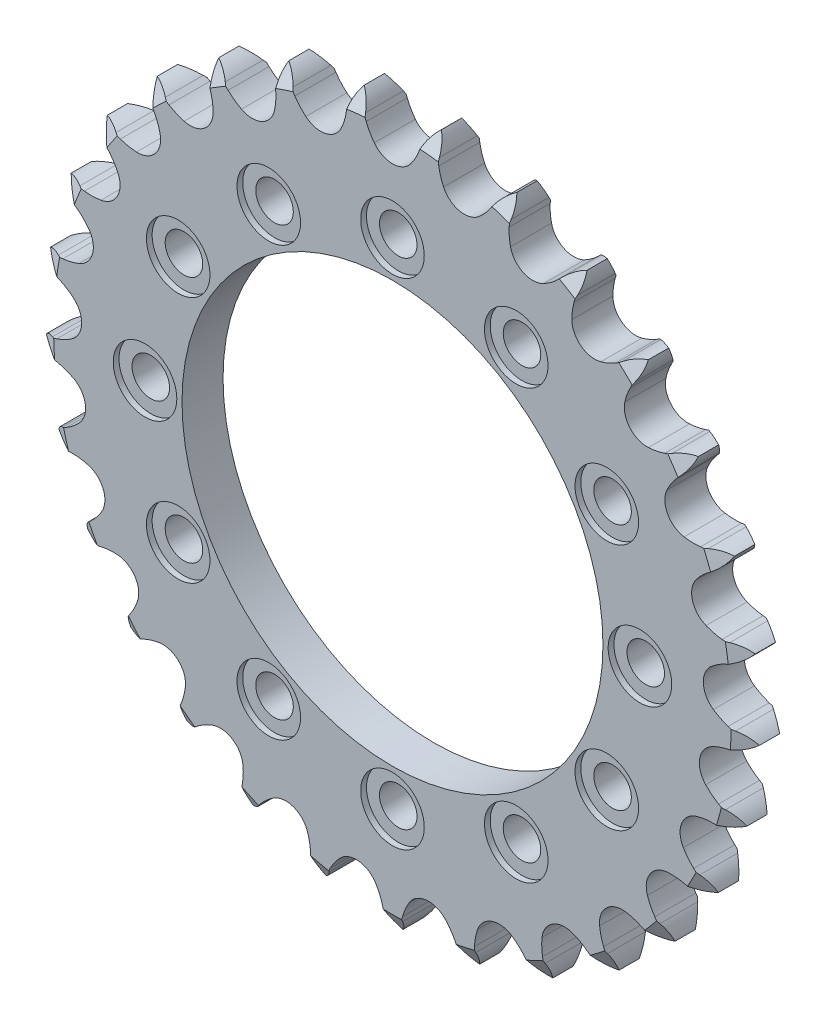
from build123d import *

# Parameters (mm, degrees)
EXTRUSION_DEPTH         = 7.2136
CIRPATTERN1_COUNT       = 12
CUT_EXTRUDE1_DEPTH      = 89.992024243
CUT_EXTRUDE1_DEPTH_BACK = 89.992024243
SKETCH8_R               = 37
CUT_EXTRUDE2_START      = 7.2136
SKETCH10_R              = 5.588
CUT_EXTRUDE2_DEPTH      = 1.016
CIRPATTERN2_COUNT       = 12


with BuildPart() as part:
    # Teeth Sketch → Extrusion (new body)
    with BuildSketch(Plane.XY):
        with BuildLine():
            ThreePointArc((6.786176664, 62.397863982), (5.741537534, 61.231594455), (5.007677749, 59.848516243))
            Line((5.007677749, 59.848516243), (4.620746237, 58.840525191))
            ThreePointArc((4.620746237, 58.840525191), (3.998321078, 57.527942204), (3.198691208, 56.315144097))
            ThreePointArc((3.198691208, 56.315144097), (0, 54.72273841), (-3.198691208, 56.315144097))
            ThreePointArc((-3.198691208, 56.315144097), (-3.998321078, 57.527942204), (-4.620746237, 58.840525191))
            Line((-4.620746237, 58.840525191), (-5.007677749, 59.848516243))
            ThreePointArc((-5.007677749, 59.848516243), (-5.741537534, 61.231594455), (-6.786176664, 62.397863982))
            ThreePointArc((-6.786176664, 62.397863982), (-7.555679238, 61.034294654), (-7.975060857, 59.525793882))
            Line((-7.975060857, 59.525793882), (-8.136257845, 58.458190263))
            ThreePointArc((-8.136257845, 58.458190263), (-8.461964507, 57.042491726), (-8.982183732, 55.68615138))
            ThreePointArc((-8.982183732, 55.68615138), (-11.763771166, 53.443351196), (-15.229998902, 54.310903266))
            ThreePointArc((-15.229998902, 54.310903266), (-16.271649613, 55.323450042), (-17.16168936, 56.471542558))
            Line((-17.16168936, 56.471542558), (-17.756262909, 57.372788502))
            ThreePointArc((-17.756262909, 57.372788502), (-18.770286392, 58.565772952), (-20.041215913, 59.480209213))
            ThreePointArc((-20.041215913, 59.480209213), (-20.499600846, 57.983099071), (-20.58489448, 56.419711557))
            Line((-20.58489448, 56.419711557), (-20.512819553, 55.34241533))
            ThreePointArc((-20.512819553, 55.34241533), (-20.526578036, 53.889797734), (-20.743061744, 52.453336116))
            ThreePointArc((-20.743061744, 52.453336116), (-22.977481466, 49.665012278), (-26.549168775, 49.767144961))
            ThreePointArc((-26.549168775, 49.767144961), (-27.784133897, 50.532094843), (-28.900170963, 51.462013358))
            Line((-28.900170963, 51.462013358), (-29.674584949, 52.214372935))
            ThreePointArc((-29.674584949, 52.214372935), (-30.92135752, 53.161480998), (-32.359150181, 53.781325968))
            ThreePointArc((-32.359150181, 53.781325968), (-32.484983902, 52.220678218), (-32.232201317, 50.675506225))
            Line((-32.232201317, 50.675506225), (-31.930224617, 49.638890565))
            ThreePointArc((-31.930224617, 49.638890565), (-31.63139159, 48.217276693), (-31.534017243, 46.767861152))
            ThreePointArc((-31.534017243, 46.767861152), (-33.11679027, 43.564392585), (-36.626929023, 42.896330269))
            ThreePointArc((-36.626929023, 42.896330269), (-37.99746296, 43.377915052), (-39.287312692, 44.04617761))
            Line((-39.287312692, 44.04617761), (-40.205356379, 44.614471322))
            ThreePointArc((-40.205356379, 44.614471322), (-41.626580336, 45.271417276), (-43.16400655, 45.567687695))
            ThreePointArc((-43.16400655, 45.567687695), (-42.951405215, 44.016476492), (-42.372366243, 42.561770545))
            Line((-42.372366243, 42.561770545), (-41.854607866, 41.614306446))
            ThreePointArc((-41.854607866, 41.614306446), (-41.257156429, 40.290169385), (-40.850477143, 38.895572979))
            ThreePointArc((-40.850477143, 38.895572979), (-41.707594769, 35.426750312), (-44.992054777, 34.019730849))
            ThreePointArc((-44.992054777, 34.019730849), (-46.434072886, 34.195432164), (-47.837423344, 34.57079155))
            Line((-47.837423344, 34.57079155), (-48.856170029, 34.928446616))
            ThreePointArc((-48.856170029, 34.928446616), (-50.385390521, 35.264512399), (-51.950561947, 35.223354989))
            ThreePointArc((-51.950561947, 35.223354989), (-51.409466558, 33.754113245), (-50.531246417, 32.457893777))
            Line((-50.531246417, 32.457893777), (-49.821916169, 31.643883609))
            ThreePointArc((-49.821916169, 31.643883609), (-48.953782488, 30.479138535), (-48.256814134, 29.204571043))
            ThreePointArc((-48.256814134, 29.204571043), (-48.34819849, 25.632592569), (-51.253402056, 23.552406626))
            ThreePointArc((-51.253402056, 23.552406626), (-52.699477171, 23.414008874), (-54.150709248, 23.478913701))
            Line((-54.150709248, 23.478913701), (-55.222523469, 23.609206566))
            ThreePointArc((-55.222523469, 23.609206566), (-56.788235845, 23.608678115), (-58.307966806, 23.232017353))
            ThreePointArc((-58.307966806, 23.232017353), (-57.463678382, 21.913445178), (-56.32734167, 20.836321971))
            Line((-56.32734167, 20.836321971), (-55.459607045, 20.193827944))
            ThreePointArc((-55.459607045, 20.193827944), (-54.361384085, 19.242937042), (-53.406716129, 18.147995824))
            ThreePointArc((-53.406716129, 18.147995824), (-52.728094186, 14.639883287), (-55.118197218, 11.983798045))
            ThreePointArc((-55.118197218, 11.983798045), (-56.500712475, 11.537772552), (-57.931968171, 11.289187941))
            Line((-57.931968171, 11.289187941), (-59.006733086, 11.186026256))
            ThreePointArc((-59.006733086, 11.186026256), (-60.535726376, 10.848928282), (-61.938955941, 10.154376405))
            ThreePointArc((-61.938955941, 10.154376405), (-60.830952471, 9.048128769), (-59.48963303, 8.240466908))
            Line((-59.48963303, 8.240466908), (-58.504068334, 7.799531329))
            ThreePointArc((-58.504068334, 7.799531329), (-57.227107781, 7.1069572), (-56.059379436, 6.24284049))
            ThreePointArc((-56.059379436, 6.24284049), (-54.6424828, 2.962629332), (-56.405726738, -0.145159614))
            ThreePointArc((-56.405726738, -0.145159614), (-57.66003726, -0.877957192), (-59.00439265, -1.4284077))
            Line((-59.00439265, -1.4284077), (-60.031853446, -1.760200208))
            ThreePointArc((-60.031853446, -1.760200208), (-61.452633622, -2.41810538), (-62.673748337, -3.398071897))
            ThreePointArc((-62.673748337, -3.398071897), (-61.353838831, -4.240268084), (-59.870255268, -4.74070323))
            Line((-59.870255268, -4.74070323), (-58.812944411, -4.959462704))
            ThreePointArc((-58.812944411, -4.959462704), (-57.416955521, -5.361336062), (-56.090768466, -5.954223127))
            ThreePointArc((-56.090768466, -5.954223127), (-54.001849649, -8.853153877), (-55.055787166, -12.26732977))
            ThreePointArc((-55.055787166, -12.26732977), (-56.123242787, -13.252634633), (-57.317837307, -14.079212584))
            Line((-57.317837307, -14.079212584), (-58.249951059, -14.624121667))
            ThreePointArc((-58.249951059, -14.624121667), (-59.49608402, -15.572071122), (-60.477985918, -16.791630134))
            ThreePointArc((-60.477985918, -16.791630134), (-59.007887877, -17.330394715), (-57.45141091, -17.500203353))
            Line((-57.45141091, -17.500203353), (-56.371792573, -17.486557772))
            ThreePointArc((-56.371792573, -17.486557772), (-54.922050235, -17.578939208), (-53.499415503, -17.872873888))
            ThreePointArc((-53.499415503, -17.872873888), (-50.836150027, -20.25497345), (-51.131500176, -23.81589322))
            ThreePointArc((-51.131500176, -23.81589322), (-51.962187858, -25.007633608), (-52.951163596, -26.071689135))
            Line((-52.951163596, -26.071689135), (-53.744345701, -26.804235451))
            ThreePointArc((-53.744345701, -26.804235451), (-54.757563654, -27.997904125), (-55.454340094, -29.400030409))
            ThreePointArc((-55.454340094, -29.400030409), (-53.902793669, -29.61017135), (-52.34620243, -29.441413418))
            Line((-52.34620243, -29.441413418), (-51.294758367, -29.196000833))
            ThreePointArc((-51.294758367, -29.196000833), (-49.859050921, -28.974570694), (-48.406489331, -28.95580893))
            ThreePointArc((-48.406489331, -28.95580893), (-45.293408531, -30.709692977), (-44.816361067, -34.250851973))
            ThreePointArc((-44.816361067, -34.250851973), (-45.371438776, -35.593303429), (-46.108552326, -36.84508248))
            Line((-46.108552326, -36.84508248), (-46.72571447, -37.731012976))
            ThreePointArc((-46.72571447, -37.731012976), (-47.45864047, -39.114586249), (-47.83771096, -40.633717937))
            ThreePointArc((-47.83771096, -40.633717937), (-46.277264737, -40.505409282), (-44.793343704, -40.005975713))
            Line((-44.793343704, -40.005975713), (-43.81923827, -39.540271345))
            ThreePointArc((-43.81923827, -39.540271345), (-42.464697801, -39.015383458), (-41.050129518, -38.684802529))
            ThreePointArc((-41.050129518, -38.684802529), (-37.632797591, -39.728461391), (-36.405658724, -43.084278955))
            ThreePointArc((-36.405658724, -43.084278955), (-36.659171644, -44.514669942), (-37.109956396, -45.895640718))
            Line((-37.109956396, -45.895640718), (-37.522240763, -46.893530269))
            ThreePointArc((-37.522240763, -46.893530269), (-37.940604005, -48.402313792), (-37.984243629, -49.967417976))
            ThreePointArc((-37.984243629, -49.967417976), (-36.48786234, -49.506659295), (-35.14599801, -48.699903047))
            Line((-35.14599801, -48.699903047), (-34.294779293, -48.035682714))
            ThreePointArc((-34.294779293, -48.035682714), (-33.084742607, -47.231880253), (-31.774311273, -46.604937757))
            ThreePointArc((-31.774311273, -46.604937757), (-28.212518863, -46.889571106), (-26.292668241, -49.903132937))
            ThreePointArc((-26.292668241, -49.903132937), (-26.23276239, -51.354579962), (-26.376140149, -52.800169805))
            Line((-26.376140149, -52.800169805), (-26.56426878, -53.863358205))
            ThreePointArc((-26.56426878, -53.863358205), (-26.648507064, -55.426802938), (-26.354675283, -56.964697085))
            ThreePointArc((-26.354675283, -56.964697085), (-24.992328053, -56.193032942), (-23.855264512, -55.116677041))
            Line((-23.855264512, -55.116677041), (-23.166734552, -54.284998948))
            ThreePointArc((-23.166734552, -54.284998948), (-22.157781621, -53.239866823), (-21.012761547, -52.345877892))
            ThreePointArc((-21.012761547, -52.345877892), (-17.473054108, -51.85817659), (-14.950261813, -54.388571887))
            ThreePointArc((-14.950261813, -54.388571887), (-14.579738322, -55.793206899), (-14.409004903, -57.235821635))
            Line((-14.409004903, -57.235821635), (-14.364181114, -58.314595376))
            ThreePointArc((-14.364181114, -58.314595376), (-14.110355551, -59.859596381), (-13.492791611, -61.298370271))
            ThreePointArc((-13.492791611, -61.298370271), (-12.328180284, -60.251882822), (-11.449085358, -58.956256474))
            Line((-11.449085358, -58.956256474), (-10.955439051, -57.996008964))
            ThreePointArc((-10.955439051, -57.996008964), (-10.194747392, -56.758416391), (-9.268678445, -55.639182956))
            ThreePointArc((-9.268678445, -55.639182956), (-5.916568762, -54.401951373), (-2.908797759, -56.330861663))
            ThreePointArc((-2.908797759, -56.330861663), (-2.244981894, -57.623005492), (-1.768120603, -58.995190059))
            Line((-1.768120603, -58.995190059), (-1.492440303, -60.039106879))
            ThreePointArc((-1.492440303, -60.039106879), (-0.912419494, -61.493421627), (0, -62.76579979))
            ThreePointArc((0, -62.76579979), (0.912419494, -61.493421627), (1.492440303, -60.039106879))
            Line((1.492440303, -60.039106879), (1.768120603, -58.995190059))
            ThreePointArc((1.768120603, -58.995190059), (2.244981894, -57.623005492), (2.908797759, -56.330861663))
            ThreePointArc((2.908797759, -56.330861663), (5.916568762, -54.401951373), (9.268678445, -55.639182956))
            ThreePointArc((9.268678445, -55.639182956), (10.194747392, -56.758416391), (10.955439051, -57.996008964))
            Line((10.955439051, -57.996008964), (11.449085358, -58.956256474))
            ThreePointArc((11.449085358, -58.956256474), (12.328180284, -60.251882822), (13.492791611, -61.298370271))
            ThreePointArc((13.492791611, -61.298370271), (14.110355551, -59.859596381), (14.364181114, -58.314595376))
            Line((14.364181114, -58.314595376), (14.409004903, -57.235821635))
            ThreePointArc((14.409004903, -57.235821635), (14.579738322, -55.793206899), (14.950261813, -54.388571887))
            ThreePointArc((14.950261813, -54.388571887), (17.473054108, -51.85817659), (21.012761547, -52.345877892))
            ThreePointArc((21.012761547, -52.345877892), (22.157781621, -53.239866823), (23.166734552, -54.284998948))
            Line((23.166734552, -54.284998948), (23.855264512, -55.116677041))
            ThreePointArc((23.855264512, -55.116677041), (24.992328053, -56.193032942), (26.354675283, -56.964697085))
            ThreePointArc((26.354675283, -56.964697085), (26.648507064, -55.426802938), (26.56426878, -53.863358205))
            Line((26.56426878, -53.863358205), (26.376140149, -52.800169805))
            ThreePointArc((26.376140149, -52.800169805), (26.23276239, -51.354579962), (26.292668241, -49.903132937))
            ThreePointArc((26.292668241, -49.903132937), (28.212518863, -46.889571106), (31.774311273, -46.604937757))
            ThreePointArc((31.774311273, -46.604937757), (33.084742607, -47.231880253), (34.294779293, -48.035682714))
            Line((34.294779293, -48.035682714), (35.14599801, -48.699903047))
            ThreePointArc((35.14599801, -48.699903047), (36.48786234, -49.506659295), (37.984243629, -49.967417976))
            ThreePointArc((37.984243629, -49.967417976), (37.940604005, -48.402313792), (37.522240763, -46.893530269))
            Line((37.522240763, -46.893530269), (37.109956396, -45.895640718))
            ThreePointArc((37.109956396, -45.895640718), (36.659171644, -44.514669942), (36.405658724, -43.084278955))
            ThreePointArc((36.405658724, -43.084278955), (37.632797591, -39.728461391), (41.050129518, -38.684802529))
            ThreePointArc((41.050129518, -38.684802529), (42.464697801, -39.015383458), (43.81923827, -39.540271345))
            Line((43.81923827, -39.540271345), (44.793343704, -40.005975713))
            ThreePointArc((44.793343704, -40.005975713), (46.277264737, -40.505409282), (47.83771096, -40.633717937))
            ThreePointArc((47.83771096, -40.633717937), (47.45864047, -39.114586249), (46.72571447, -37.731012976))
            Line((46.72571447, -37.731012976), (46.108552326, -36.84508248))
            ThreePointArc((46.108552326, -36.84508248), (45.371438776, -35.593303429), (44.816361067, -34.250851973))
            ThreePointArc((44.816361067, -34.250851973), (45.293408531, -30.709692977), (48.406489331, -28.95580893))
            ThreePointArc((48.406489331, -28.95580893), (49.859050921, -28.974570694), (51.294758367, -29.196000833))
            Line((51.294758367, -29.196000833), (52.34620243, -29.441413418))
            ThreePointArc((52.34620243, -29.441413418), (53.902793669, -29.61017135), (55.454340094, -29.400030409))
            ThreePointArc((55.454340094, -29.400030409), (54.757563654, -27.997904125), (53.744345701, -26.804235451))
            Line((53.744345701, -26.804235451), (52.951163596, -26.071689135))
            ThreePointArc((52.951163596, -26.071689135), (51.962187858, -25.007633608), (51.131500176, -23.81589322))
            ThreePointArc((51.131500176, -23.81589322), (50.836150027, -20.25497345), (53.499415503, -17.872873888))
            ThreePointArc((53.499415503, -17.872873888), (54.922050235, -17.578939208), (56.371792573, -17.486557772))
            Line((56.371792573, -17.486557772), (57.45141091, -17.500203353))
            ThreePointArc((57.45141091, -17.500203353), (59.007887877, -17.330394715), (60.477985918, -16.791630134))
            ThreePointArc((60.477985918, -16.791630134), (59.49608402, -15.572071122), (58.249951059, -14.624121667))
            Line((58.249951059, -14.624121667), (57.317837307, -14.079212584))
            ThreePointArc((57.317837307, -14.079212584), (56.123242787, -13.252634633), (55.055787166, -12.26732977))
            ThreePointArc((55.055787166, -12.26732977), (54.001849649, -8.853153877), (56.090768466, -5.954223127))
            ThreePointArc((56.090768466, -5.954223127), (57.416955521, -5.361336062), (58.812944411, -4.959462704))
            Line((58.812944411, -4.959462704), (59.870255268, -4.74070323))
            ThreePointArc((59.870255268, -4.74070323), (61.353838831, -4.240268084), (62.673748337, -3.398071897))
            ThreePointArc((62.673748337, -3.398071897), (61.452633622, -2.41810538), (60.031853446, -1.760200208))
            Line((60.031853446, -1.760200208), (59.00439265, -1.4284077))
            ThreePointArc((59.00439265, -1.4284077), (57.66003726, -0.877957192), (56.405726738, -0.145159614))
            ThreePointArc((56.405726738, -0.145159614), (54.6424828, 2.962629332), (56.059379436, 6.24284049))
            ThreePointArc((56.059379436, 6.24284049), (57.227107781, 7.1069572), (58.504068334, 7.799531329))
            Line((58.504068334, 7.799531329), (59.48963303, 8.240466908))
            ThreePointArc((59.48963303, 8.240466908), (60.830952471, 9.048128769), (61.938955941, 10.154376405))
            ThreePointArc((61.938955941, 10.154376405), (60.535726376, 10.848928282), (59.006733086, 11.186026256))
            Line((59.006733086, 11.186026256), (57.931968171, 11.289187941))
            ThreePointArc((57.931968171, 11.289187941), (56.500712475, 11.537772552), (55.118197218, 11.983798045))
            ThreePointArc((55.118197218, 11.983798045), (52.728094186, 14.639883287), (53.406716129, 18.147995824))
            ThreePointArc((53.406716129, 18.147995824), (54.361384085, 19.242937042), (55.459607045, 20.193827944))
            Line((55.459607045, 20.193827944), (56.32734167, 20.836321971))
            ThreePointArc((56.32734167, 20.836321971), (57.463678382, 21.913445178), (58.307966806, 23.232017353))
            ThreePointArc((58.307966806, 23.232017353), (56.788235845, 23.608678115), (55.222523469, 23.609206566))
            Line((55.222523469, 23.609206566), (54.150709248, 23.478913701))
            ThreePointArc((54.150709248, 23.478913701), (52.699477171, 23.414008874), (51.253402056, 23.552406626))
            ThreePointArc((51.253402056, 23.552406626), (48.34819849, 25.632592569), (48.256814134, 29.204571043))
            ThreePointArc((48.256814134, 29.204571043), (48.953782488, 30.479138535), (49.821916169, 31.643883609))
            Line((49.821916169, 31.643883609), (50.531246417, 32.457893777))
            ThreePointArc((50.531246417, 32.457893777), (51.409466558, 33.754113245), (51.950561947, 35.223354989))
            ThreePointArc((51.950561947, 35.223354989), (50.385390521, 35.264512399), (48.856170029, 34.928446616))
            Line((48.856170029, 34.928446616), (47.837423344, 34.57079155))
            ThreePointArc((47.837423344, 34.57079155), (46.434072886, 34.195432164), (44.992054777, 34.019730849))
            ThreePointArc((44.992054777, 34.019730849), (41.707594769, 35.426750312), (40.850477143, 38.895572979))
            ThreePointArc((40.850477143, 38.895572979), (41.257156429, 40.290169385), (41.854607866, 41.614306446))
            Line((41.854607866, 41.614306446), (42.372366243, 42.561770545))
            ThreePointArc((42.372366243, 42.561770545), (42.951405215, 44.016476492), (43.16400655, 45.567687695))
            ThreePointArc((43.16400655, 45.567687695), (41.626580336, 45.271417276), (40.205356379, 44.614471322))
            Line((40.205356379, 44.614471322), (39.287312692, 44.04617761))
            ThreePointArc((39.287312692, 44.04617761), (37.99746296, 43.377915052), (36.626929023, 42.896330269))
            ThreePointArc((36.626929023, 42.896330269), (33.11679027, 43.564392585), (31.534017243, 46.767861152))
            ThreePointArc((31.534017243, 46.767861152), (31.63139159, 48.217276693), (31.930224617, 49.638890565))
            Line((31.930224617, 49.638890565), (32.232201317, 50.675506225))
            ThreePointArc((32.232201317, 50.675506225), (32.484983902, 52.220678218), (32.359150181, 53.781325968))
            ThreePointArc((32.359150181, 53.781325968), (30.92135752, 53.161480998), (29.674584949, 52.214372935))
            Line((29.674584949, 52.214372935), (28.900170963, 51.462013358))
            ThreePointArc((28.900170963, 51.462013358), (27.784133897, 50.532094843), (26.549168775, 49.767144961))
            ThreePointArc((26.549168775, 49.767144961), (22.977481466, 49.665012278), (20.743061744, 52.453336116))
            ThreePointArc((20.743061744, 52.453336116), (20.526578036, 53.889797734), (20.512819553, 55.34241533))
            Line((20.512819553, 55.34241533), (20.58489448, 56.419711557))
            ThreePointArc((20.58489448, 56.419711557), (20.499600846, 57.983099071), (20.041215913, 59.480209213))
            ThreePointArc((20.041215913, 59.480209213), (18.770286392, 58.565772952), (17.756262909, 57.372788502))
            Line((17.756262909, 57.372788502), (17.16168936, 56.471542558))
            ThreePointArc((17.16168936, 56.471542558), (16.271649613, 55.323450042), (15.229998902, 54.310903266))
            ThreePointArc((15.229998902, 54.310903266), (11.763771166, 53.443351196), (8.982183732, 55.68615138))
            ThreePointArc((8.982183732, 55.68615138), (8.461964507, 57.042491726), (8.136257845, 58.458190263))
            Line((8.136257845, 58.458190263), (7.975060857, 59.525793882))
            ThreePointArc((7.975060857, 59.525793882), (7.555679238, 61.034294654), (6.786176664, 62.397863982))
        make_face()
    extrude(amount=EXTRUSION_DEPTH)

    # Sketch7 → M6 Clearance Hole1 (revolve, cut)
    with BuildSketch(Plane(origin=(0, 43.500000122, 0), x_dir=(0, 1, 0), z_dir=(1, 0, 0))):
        Polygon((0, 0), (0, 19.254840043), (3.3, 17.272), (3.3, 0), align=None)
    m6_clearance_hole1 = revolve(axis=Axis((0, 43.500000122, -6.35), (0, 0, 1)), mode=Mode.SUBTRACT)

    # CirPattern1: M6 Clearance Hole1 ×12 about axis
    cirpattern1_axis = Axis((0, 0, 0), (0, 0, 1))
    for i in range(1, CIRPATTERN1_COUNT):
        add(m6_clearance_hole1.rotate(cirpattern1_axis, i * 360 / CIRPATTERN1_COUNT), mode=Mode.SUBTRACT)

    # Sketch8 → Cut-Extrude1 (cut, two sides: drawn at the far end of the back side and taken through both)
    with BuildSketch(Plane(origin=(0, 0, 0), x_dir=(-1, 0, 0), z_dir=(0, 0, -1)).offset(-CUT_EXTRUDE1_DEPTH_BACK)):
        Circle(SKETCH8_R)
    extrude(amount=CUT_EXTRUDE1_DEPTH + CUT_EXTRUDE1_DEPTH_BACK, mode=Mode.SUBTRACT)

    # Sketch5 → Cut-Revolve1 (revolve, cut)
    with BuildSketch(Plane(origin=(0, 0, 0), x_dir=(0, 0, -1), z_dir=(1, 0, 0))):
        Polygon((-7.2136, -59.572217658), (-7.2136, -62.76579979), (-5.3848, -62.76579979), align=None)
    cut_revolve1 = revolve(axis=Axis((0, 0, 7.2136), (0, 0, -1)), mode=Mode.SUBTRACT)

    # Mirror1: Cut-Revolve1 across plane
    add(cut_revolve1.mirror(Plane.XY.offset(3.6068)), mode=Mode.SUBTRACT)

    # Sketch10 → Cut-Extrude2 (cut)
    with BuildSketch(Plane.XY.offset(CUT_EXTRUDE2_START)):
        with Locations((-43.500000122, 0)):
            Circle(SKETCH10_R)
    cut_extrude2 = extrude(amount=-CUT_EXTRUDE2_DEPTH, mode=Mode.SUBTRACT)

    # CirPattern2: Cut-Extrude2 ×12 about axis
    cirpattern2_axis = Axis((0, 0, 0), (0, 0, 1))
    for i in range(1, CIRPATTERN2_COUNT):
        add(cut_extrude2.rotate(cirpattern2_axis, i * 360 / CIRPATTERN2_COUNT), mode=Mode.SUBTRACT)


solid = part.part
